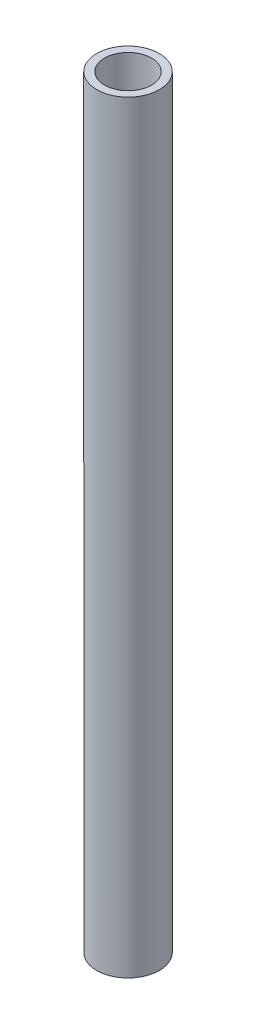
from build123d import *

# Parameters (mm, degrees)
SKETCH1_R           = 4
SKETCH1_R_2         = 3
BOSS_EXTRUDE1_DEPTH = 270
CUT_EXTRUDE1_START  = -172.552138
SKETCH2_R           = 4
SKETCH2_R_2         = 3
CUT_EXTRUDE1_DEPTH  = 172.552138


with BuildPart() as part:
    # Sketch1 → Boss-Extrude1 (new body)
    with BuildSketch(Plane(origin=(0, 0, 0), x_dir=(1, 0, 0), z_dir=(0, 1, 0))):
        with Locations(Location((0, 0, 0), (0, 0, 270))):
            Circle(SKETCH1_R)
        with Locations(Location((0, 0, 0), (0, 0, 270))):
            Circle(SKETCH1_R_2, mode=Mode.SUBTRACT)
    extrude(amount=BOSS_EXTRUDE1_DEPTH)

    # Sketch2 → Cut-Extrude1 (cut)
    with BuildSketch(Plane(origin=(0, 270, 0), x_dir=(1, 0, 0), z_dir=(0, 1, 0)).offset(CUT_EXTRUDE1_START)):
        Circle(SKETCH2_R)
        Circle(SKETCH2_R_2, mode=Mode.SUBTRACT)
    extrude(amount=CUT_EXTRUDE1_DEPTH, mode=Mode.SUBTRACT)


solid = part.part
